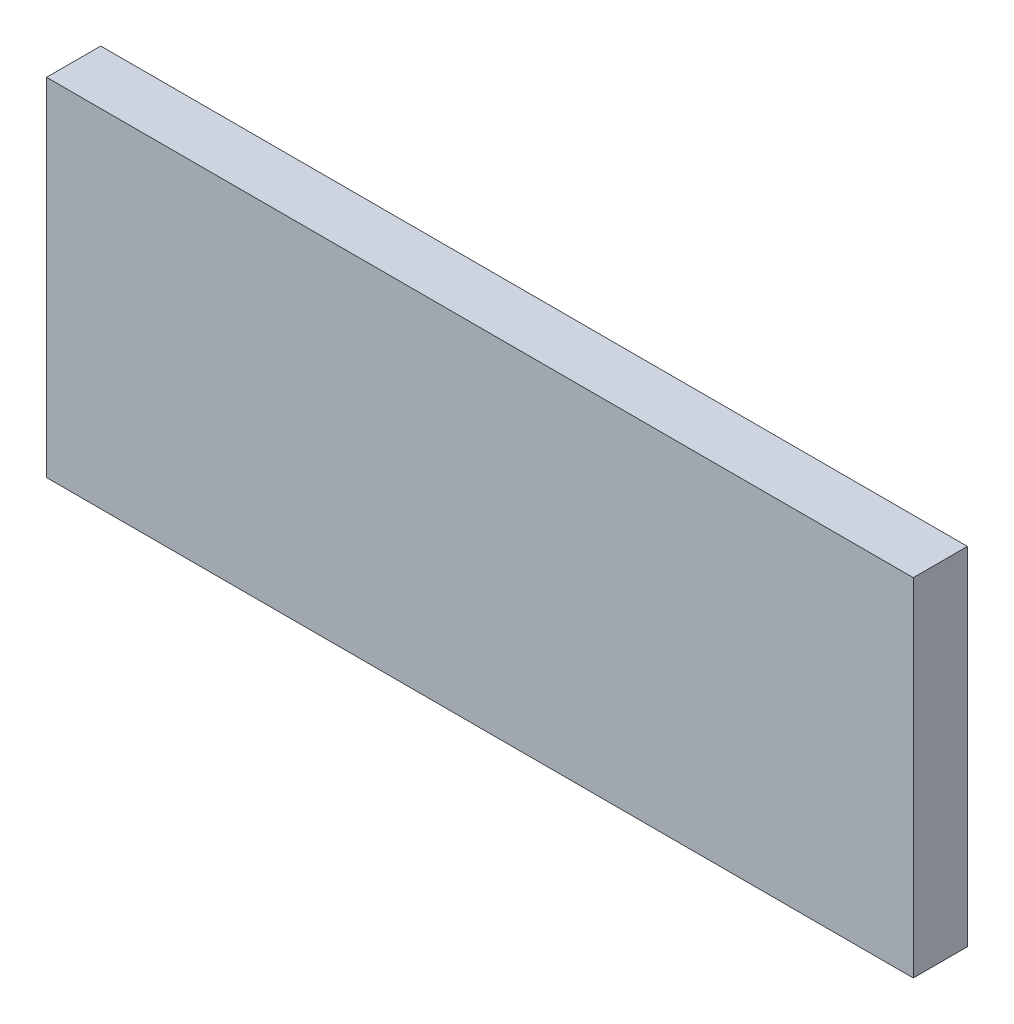
from build123d import *

# Parameters (mm, degrees)
SKETCH1_W           = 32
SKETCH1_H           = 80
BOSS_EXTRUDE1_DEPTH = 5


with BuildPart() as part:
    # Sketch1 → Boss-Extrude1 (new body)
    with BuildSketch(Plane(origin=(0, 0, 0), x_dir=(0, 1, 0), z_dir=(0, 0, 1))):
        Rectangle(SKETCH1_W, SKETCH1_H)
    extrude(amount=BOSS_EXTRUDE1_DEPTH)


solid = part.part
